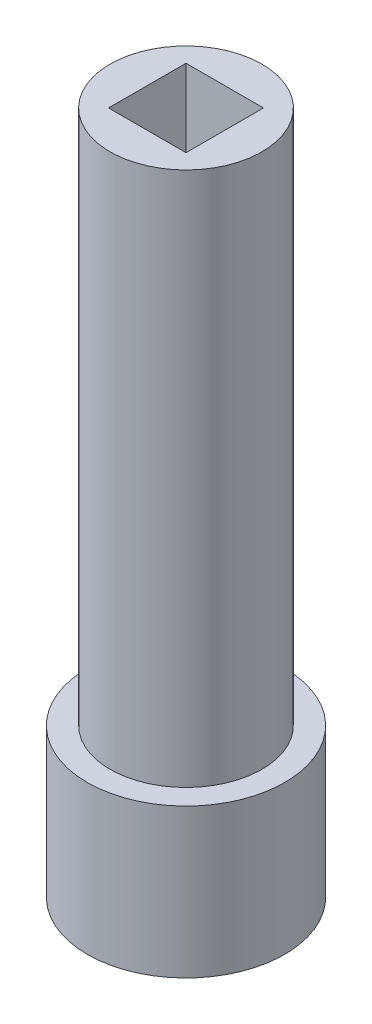
from build123d import *

# Parameters (mm, degrees)
SKETCH1_R           = 5
BOSS_EXTRUDE1_DEPTH = 45
SKETCH2_W           = 5.1
SKETCH2_H           = 5.1
CUT_EXTRUDE1_DEPTH  = 22
SKETCH3_R           = 6.5
BOSS_EXTRUDE2_DEPTH = 9.8


with BuildPart() as part:
    # Sketch1 → Boss-Extrude1 (new body)
    with BuildSketch(Plane(origin=(0, 0, 0), x_dir=(1, 0, 0), z_dir=(0, 1, 0))):
        with Locations(Location((0, 0, 0), (0, 0, 90))):
            Circle(SKETCH1_R)
    extrude(amount=BOSS_EXTRUDE1_DEPTH)

    # Sketch2 → Cut-Extrude1 (cut)
    with BuildSketch(Plane(origin=(0, 45, 0), x_dir=(1, 0, 0), z_dir=(0, 1, 0))):
        Rectangle(SKETCH2_W, SKETCH2_H)
    extrude(amount=-CUT_EXTRUDE1_DEPTH, mode=Mode.SUBTRACT)

    # Sketch3 → Boss-Extrude2 (add)
    with BuildSketch(Plane.XZ):
        with Locations(Location((0, 0, 0), (0, 0, 270))):
            Circle(SKETCH3_R)
    extrude(amount=-BOSS_EXTRUDE2_DEPTH)


solid = part.part
